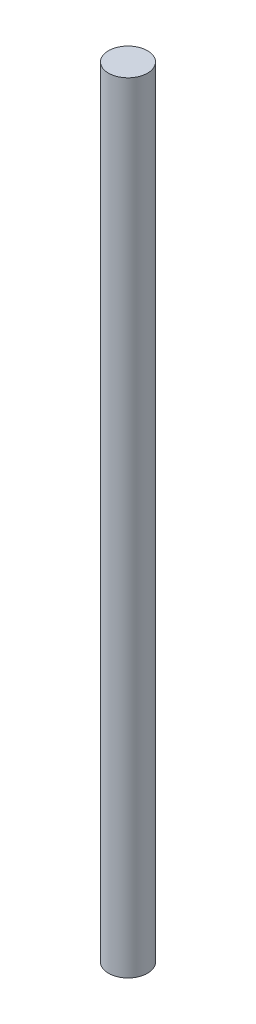
from build123d import *

# Parameters (mm, degrees)
SKETCH1_R           = 1.5875
BOSS_EXTRUDE1_DEPTH = 63.5


with BuildPart() as part:
    # Sketch1 → Boss-Extrude1 (new body)
    with BuildSketch(Plane(origin=(0, 0, 0), x_dir=(1, 0, 0), z_dir=(0, 1, 0))):
        with Locations(Location((0, 0, 0), (0, 0, 270))):
            Circle(SKETCH1_R)
    extrude(amount=BOSS_EXTRUDE1_DEPTH)


solid = part.part
